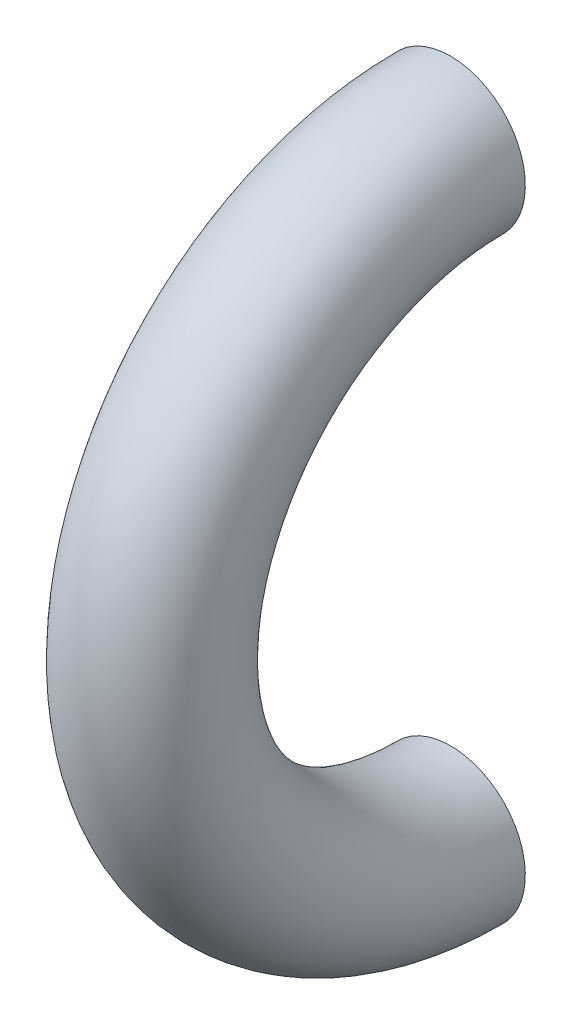
from build123d import *

# Parameters (mm, degrees)
SKETCH_1_R = 20


with BuildPart() as part:
    # 扫描2: sweep along a path in 草图2
    with BuildLine(Plane(origin=(0, 0, 0), x_dir=(0, 0, -1), z_dir=(1, 0, 0))) as sweep_2_path:
        ThreePointArc((0, 0), (-80, -80), (0, -160))
    # 草图1 → 扫描2 (sweep)
    with BuildSketch(Plane.XY):
        Circle(SKETCH_1_R)
    sweep(path=sweep_2_path.line)


solid = part.part
